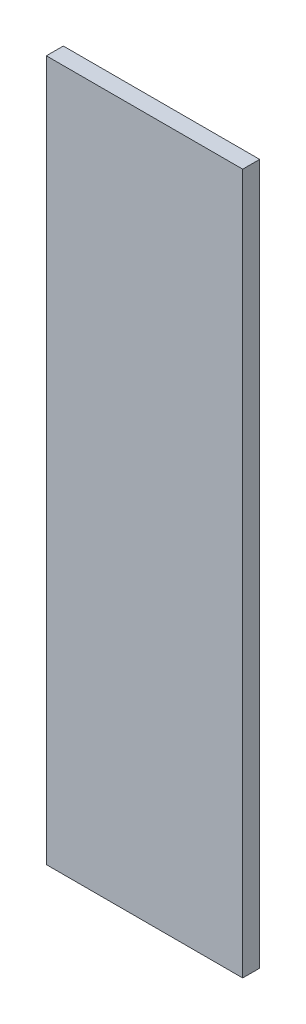
from build123d import *

# Parameters (mm, degrees)
SKETCH1_W           = 220.726
SKETCH1_H           = 787.4
BOSS_EXTRUDE1_DEPTH = 19.05


with BuildPart() as part:
    # Sketch1 → Boss-Extrude1 (new body)
    with BuildSketch(Plane.XY):
        with Locations((110.363, 393.7)):
            Rectangle(SKETCH1_W, SKETCH1_H)
    extrude(amount=BOSS_EXTRUDE1_DEPTH)


solid = part.part
